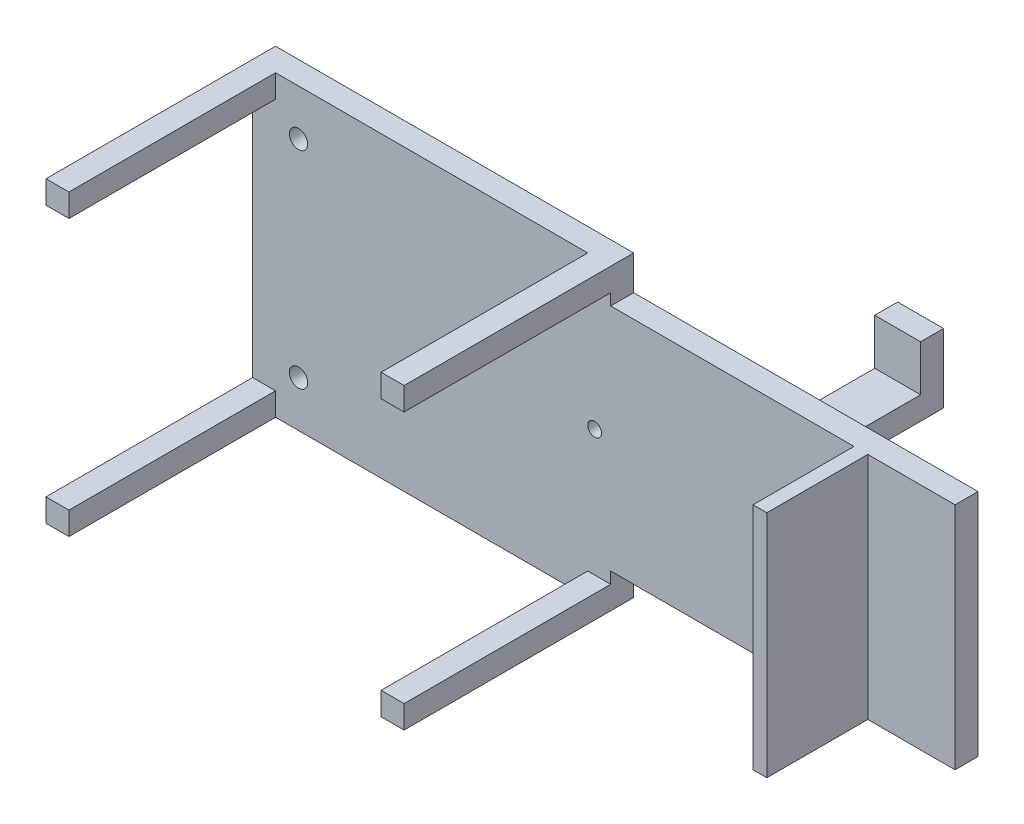
from build123d import *

# Parameters (mm, degrees)
CROQUIS1_R               = 2
CROQUIS1_R_2             = 1.5
SALIENTE_EXTRUIR4_DEPTH  = 5
CROQUIS3_W               = 5
CROQUIS3_H               = 5
SALIENTE_EXTRUIR5_DEPTH  = 50
CROQUIS4_W               = 3
CROQUIS4_H               = 50
SALIENTE_EXTRUIR7_DEPTH  = 22
CROQUIS6_W               = 10
CROQUIS6_H               = 5
SALIENTE_EXTRUIR9_DEPTH  = 27.5
CROQUIS7_W               = 10
CROQUIS7_H               = 5
SALIENTE_EXTRUIR10_DEPTH = 10
CROQUIS8_W               = 10
CROQUIS8_H               = 5
SALIENTE_EXTRUIR11_DEPTH = 10


with BuildPart() as part:
    # Croquis1 → Saliente-Extruir4 (new body)
    with BuildSketch(Plane.XY):
        Polygon((-71.5, -27.5), (-71.5, -32.5), (-3.5, -32.5), (-3.5, -27.5), (1.5, -27.5), (1.5, -25), (76.5, -25), (76.5, 25), (1.5, 25), (1.5, 27.5), (-3.5, 27.5), (-3.5, 32.5), (-71.5, 32.5), (-71.5, 27.5), (-76.5, 27.5), (-76.5, -27.5), align=None)
        with Locations((-66.5, -22.5)):
            Circle(CROQUIS1_R, mode=Mode.SUBTRACT)
        with Locations((-2, 0)):
            Circle(CROQUIS1_R_2, mode=Mode.SUBTRACT)
        with Locations((-66.5, 22.5)):
            Circle(CROQUIS1_R, mode=Mode.SUBTRACT)
    extrude(amount=SALIENTE_EXTRUIR4_DEPTH)

    # Croquis3 → Saliente-Extruir5 (add)
    with BuildSketch(Plane(origin=(0, 0, 0), x_dir=(-1, 0, 0), z_dir=(0, 0, -1))):
        with Locations((74, 30)):
            Rectangle(CROQUIS3_W, CROQUIS3_H)
        with Locations((1, -30)):
            Rectangle(CROQUIS3_W, CROQUIS3_H)
        with Locations((1, 30)):
            Rectangle(CROQUIS3_W, CROQUIS3_H)
        with Locations((74, -30)):
            Rectangle(CROQUIS3_W, CROQUIS3_H)
    extrude(amount=-SALIENTE_EXTRUIR5_DEPTH)

    # Croquis4 → Saliente-Extruir7 (add)
    with BuildSketch(Plane.XY.offset(5)):
        with Locations((56, 0)):
            Rectangle(CROQUIS4_W, CROQUIS4_H)
    extrude(amount=SALIENTE_EXTRUIR7_DEPTH)

    # Croquis6 → Saliente-Extruir9 (add)
    with BuildSketch(Plane(origin=(0, 0, 0), x_dir=(-1, 0, 0), z_dir=(0, 0, -1))):
        with Locations((-36.5, 12)):
            Rectangle(CROQUIS6_W, CROQUIS6_H)
        with Locations((-36.5, -12)):
            Rectangle(CROQUIS6_W, CROQUIS6_H)
    extrude(amount=SALIENTE_EXTRUIR9_DEPTH)

    # Croquis7 → Saliente-Extruir10 (add)
    with BuildSketch(Plane(origin=(0, 14.5, 0), x_dir=(1, 0, 0), z_dir=(0, 1, 0))):
        with Locations((36.5, 25)):
            Rectangle(CROQUIS7_W, CROQUIS7_H)
    extrude(amount=SALIENTE_EXTRUIR10_DEPTH)

    # Croquis8 → Saliente-Extruir11 (add)
    with BuildSketch(Plane.XZ.offset(14.5)):
        with Locations((36.5, -25)):
            Rectangle(CROQUIS8_W, CROQUIS8_H)
    extrude(amount=SALIENTE_EXTRUIR11_DEPTH)


solid = part.part
